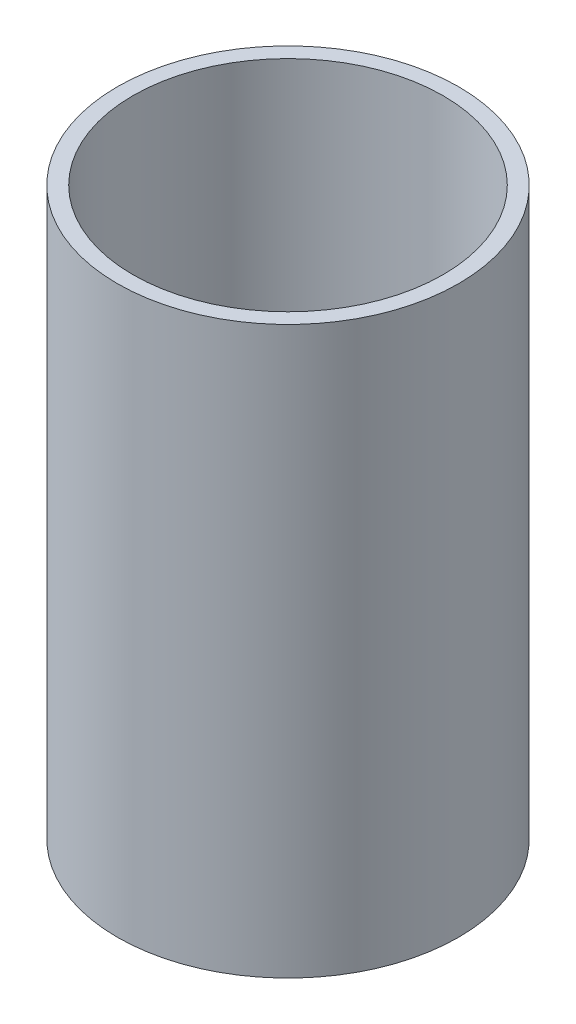
from build123d import *

# Parameters (mm, degrees)
SKETCH1_R           = 22
SKETCH1_R_2         = 20
BOSS_EXTRUDE1_DEPTH = 73


with BuildPart() as part:
    # Sketch1 → Boss-Extrude1 (new body)
    with BuildSketch(Plane(origin=(0, 0, 0), x_dir=(1, 0, 0), z_dir=(0, 1, 0))):
        with Locations(Location((0, 0, 0), (0, 0, 270))):
            Circle(SKETCH1_R)
        with Locations(Location((0, 0, 0), (0, 0, 270))):
            Circle(SKETCH1_R_2, mode=Mode.SUBTRACT)
    extrude(amount=BOSS_EXTRUDE1_DEPTH)


solid = part.part
